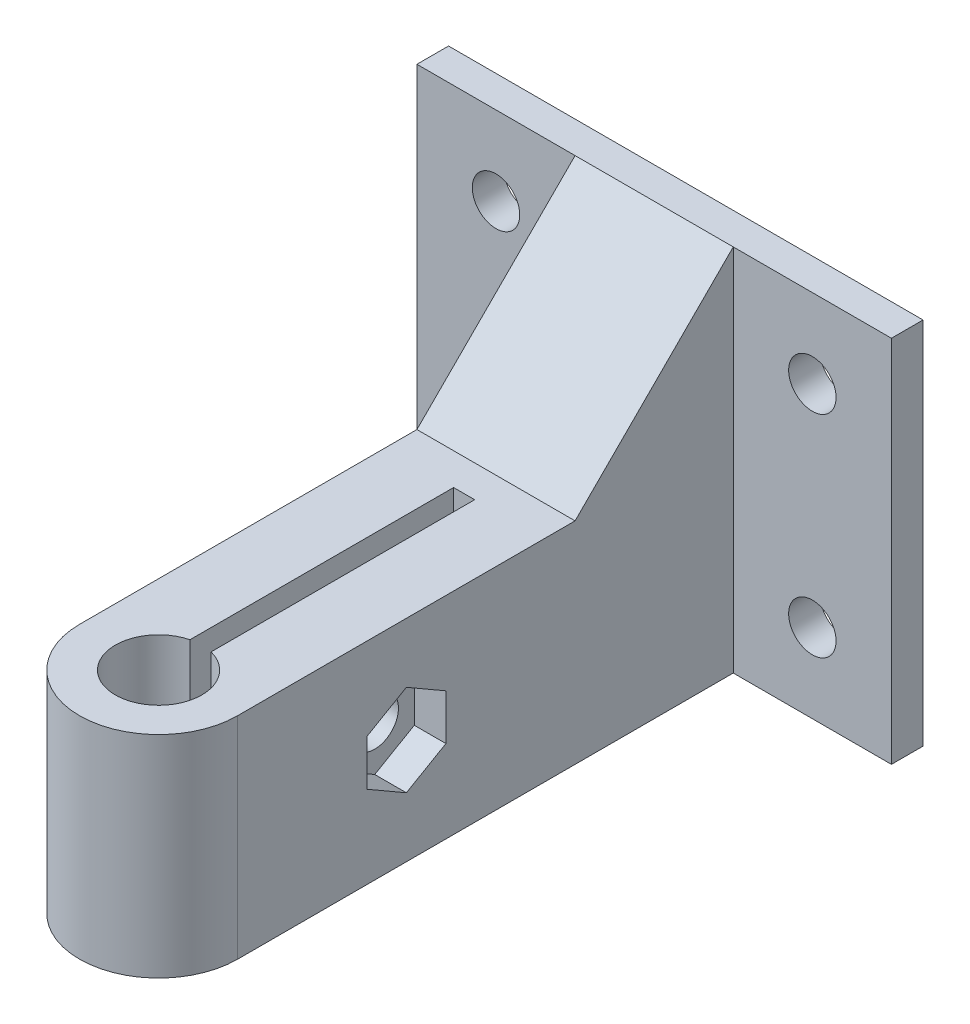
from build123d import *

# Parameters (mm, degrees)
SKETCH1_W           = 45
SKETCH1_H           = 45
SKETCH1_R           = 2.25
BOSS_EXTRUDE1_DEPTH = 3
BOSS_EXTRUDE2_DEPTH = 20
CHAMFER1_SIZE       = 15
SKETCH4_R           = 2.25
CUT_EXTRUDE1_DEPTH  = 20
CUT_EXTRUDE2_DEPTH  = 3
SKETCH6_W           = 45
SKETCH6_H           = 10
CUT_EXTRUDE3_DEPTH  = 10


with BuildPart() as part:
    # Sketch1 → Boss-Extrude1 (new body)
    with BuildSketch(Plane.XY):
        Rectangle(SKETCH1_W, SKETCH1_H)
        with Locations((-15, 5)):
            Circle(SKETCH1_R, mode=Mode.SUBTRACT)
        with Locations((15, 5)):
            Circle(SKETCH1_R, mode=Mode.SUBTRACT)
        with Locations((15, -15)):
            Circle(SKETCH1_R, mode=Mode.SUBTRACT)
        with Locations((-15, -15)):
            Circle(SKETCH1_R, mode=Mode.SUBTRACT)
    extrude(amount=BOSS_EXTRUDE1_DEPTH)

    # Sketch3 → Boss-Extrude2 (add)
    with BuildSketch(Plane(origin=(0, -22.5, 0), x_dir=(-1, 0, 0), z_dir=(0, -1, 0))):
        with BuildLine():
            Line((7.5, -3), (-7.5, -3))
            Line((-7.5, -3), (-7.5, -50))
            ThreePointArc((-7.5, -50), (0, -57.5), (7.5, -50))
            Line((7.5, -50), (7.5, -3))
        make_face()
        with BuildLine():
            Line((1, -46.02382093), (1, -21.02382093))
            Line((1, -21.02382093), (-1, -21.02382093))
            Line((-1, -21.02382093), (-1, -46.02382093))
            ThreePointArc((-1, -46.02382093), (0, -54.1), (1, -46.02382093))
        make_face(mode=Mode.SUBTRACT)
    extrude(amount=-BOSS_EXTRUDE2_DEPTH)

    # Chamfer1
    chamfer1_edges = [part.edges().sort_by_distance(p)[0] for p in [
        (0, -2.5, 3),
    ]]
    chamfer(chamfer1_edges, length=CHAMFER1_SIZE)

    # Sketch4 → Cut-Extrude1 (cut)
    with BuildSketch(Plane.ZY.offset(7.5)):
        with Locations((34, -12.5)):
            Circle(SKETCH4_R)
    extrude(amount=-CUT_EXTRUDE1_DEPTH, mode=Mode.SUBTRACT)

    # Sketch5 → Cut-Extrude2 (cut)
    with BuildSketch(Plane(origin=(7.5, 0, 0), x_dir=(0, 0, -1), z_dir=(1, 0, 0))):
        Polygon((-34, -16.830127019), (-30.25, -14.665063509), (-30.25, -10.334936491), (-34, -8.169872981), (-37.75, -10.334936491), (-37.75, -14.665063509), align=None)
    extrude(amount=-CUT_EXTRUDE2_DEPTH, mode=Mode.SUBTRACT)

    # Sketch6 → Cut-Extrude3 (cut)
    with BuildSketch(Plane.XY.offset(3)):
        with Locations((0, 17.5)):
            Rectangle(SKETCH6_W, SKETCH6_H)
    extrude(amount=-CUT_EXTRUDE3_DEPTH, mode=Mode.SUBTRACT)


solid = part.part
